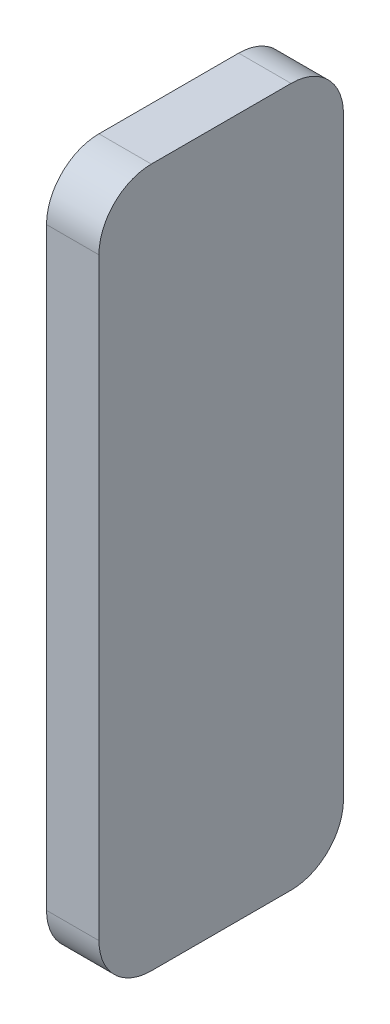
from build123d import *

# Parameters (mm, degrees)
SKETCH1_W           = 70
SKETCH1_H           = 200
BOSS_EXTRUDE1_DEPTH = 15
SKETCH1_3_R         = 7.5
CUT_EXTRUDE1_DEPTH  = 5
FILLET1_R           = 15


with BuildPart() as part:
    # Sketch1 → Boss-Extrude1 (new body)
    with BuildSketch(Plane(origin=(0, 0, 0), x_dir=(0, 0, -1), z_dir=(1, 0, 0))):
        Rectangle(SKETCH1_W, SKETCH1_H)
    extrude(amount=BOSS_EXTRUDE1_DEPTH)

    # Sketch1<3> → Cut-Extrude1 (cut)
    with BuildSketch(Plane(origin=(0, 0, 0), x_dir=(0, 0, -1), z_dir=(1, 0, 0))):
        with Locations((0, 80)):
            Circle(SKETCH1_3_R)
        with Locations((0, -80)):
            Circle(SKETCH1_3_R)
    extrude(amount=CUT_EXTRUDE1_DEPTH, mode=Mode.SUBTRACT)

    # Fillet1
    fillet1_edges = [part.edges().sort_by_distance(p)[0] for p in [
        (7.5, -100, -35),
        (7.5, -100, 35),
        (7.5, 100, -35),
        (7.5, 100, 35),
    ]]
    fillet(fillet1_edges, radius=FILLET1_R)


solid = part.part
